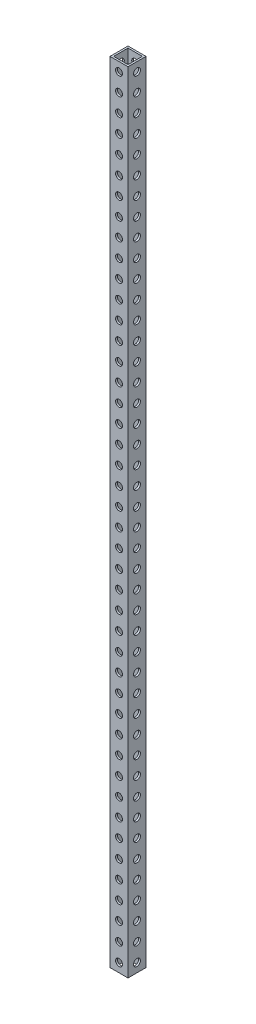
from build123d import *

# Parameters (mm, degrees)
SKETCH12_W                         = 25.4
SKETCH12_H                         = 25.4
SKETCH12_W_2                       = 20.32
SKETCH12_H_2                       = 20.32
RECTANGULAR_TUBE_1IN_X_1IN_1_DEPTH = 1117.6
F_3_8_CLEARANCE_HOLE1_D            = 9.8044
F_3_8_CLEARANCE_HOLE2_D            = 9.8044


with BuildPart() as part:
    # Sketch12 → Rectangular tube 1IN X 1IN(1) (new body)
    with BuildSketch(Plane(origin=(-12.7, -558.8, -12.7), x_dir=(0, 0, 1), z_dir=(0, 1, 0))):
        with Locations((12.7, 12.7)):
            Rectangle(SKETCH12_W, SKETCH12_H)
        with Locations((12.7, 12.7)):
            Rectangle(SKETCH12_W_2, SKETCH12_H_2, mode=Mode.SUBTRACT)
    extrude(amount=RECTANGULAR_TUBE_1IN_X_1IN_1_DEPTH)

    # 3/8 Clearance Hole1 (through all)
    with Locations(Plane.ZY.offset(12.7)):
        with Locations((0, 546.1), (0, 520.7), (0, 495.3), (0, 469.9), (0, 444.5), (0, 419.1), (0, 393.7), (0, 368.3), (0, 342.9), (0, 317.5), (0, 292.1), (0, 266.7), (0, 241.3), (0, 215.9), (0, 190.5), (0, 165.1), (0, 139.7), (0, 114.3), (0, 88.9), (0, 63.5), (0, 38.1), (0, 12.7), (0, -12.7), (0, -38.1), (0, -63.5), (0, -88.9), (0, -114.3), (0, -139.7), (0, -165.1), (0, -190.5), (0, -215.9), (0, -241.3), (0, -266.7), (0, -292.1), (0, -317.5), (0, -342.9), (0, -368.3), (0, -393.7), (0, -419.1), (0, -444.5), (0, -469.9), (0, -495.3), (0, -520.7), (0, -546.1), (0, -571.5), (0, -596.9), (0, -622.3), (0, -647.7)):
            Hole(F_3_8_CLEARANCE_HOLE1_D / 2)

    # 3/8 Clearance Hole2 (through all)
    with Locations(Plane.XY.offset(12.7)):
        with Locations((0, 546.1), (0, 520.7), (0, 495.3), (0, 469.9), (0, 444.5), (0, 419.1), (0, 393.7), (0, 368.3), (0, 342.9), (0, 317.5), (0, 292.1), (0, 266.7), (0, 241.3), (0, 215.9), (0, 190.5), (0, 165.1), (0, 139.7), (0, 114.3), (0, 88.9), (0, 63.5), (0, 38.1), (0, 12.7), (0, -12.7), (0, -38.1), (0, -63.5), (0, -88.9), (0, -114.3), (0, -139.7), (0, -165.1), (0, -190.5), (0, -215.9), (0, -241.3), (0, -266.7), (0, -292.1), (0, -317.5), (0, -342.9), (0, -368.3), (0, -393.7), (0, -419.1), (0, -444.5), (0, -469.9), (0, -495.3), (0, -520.7), (0, -546.1), (0, -571.5), (0, -596.9), (0, -622.3), (0, -647.7)):
            Hole(F_3_8_CLEARANCE_HOLE2_D / 2)


solid = part.part
